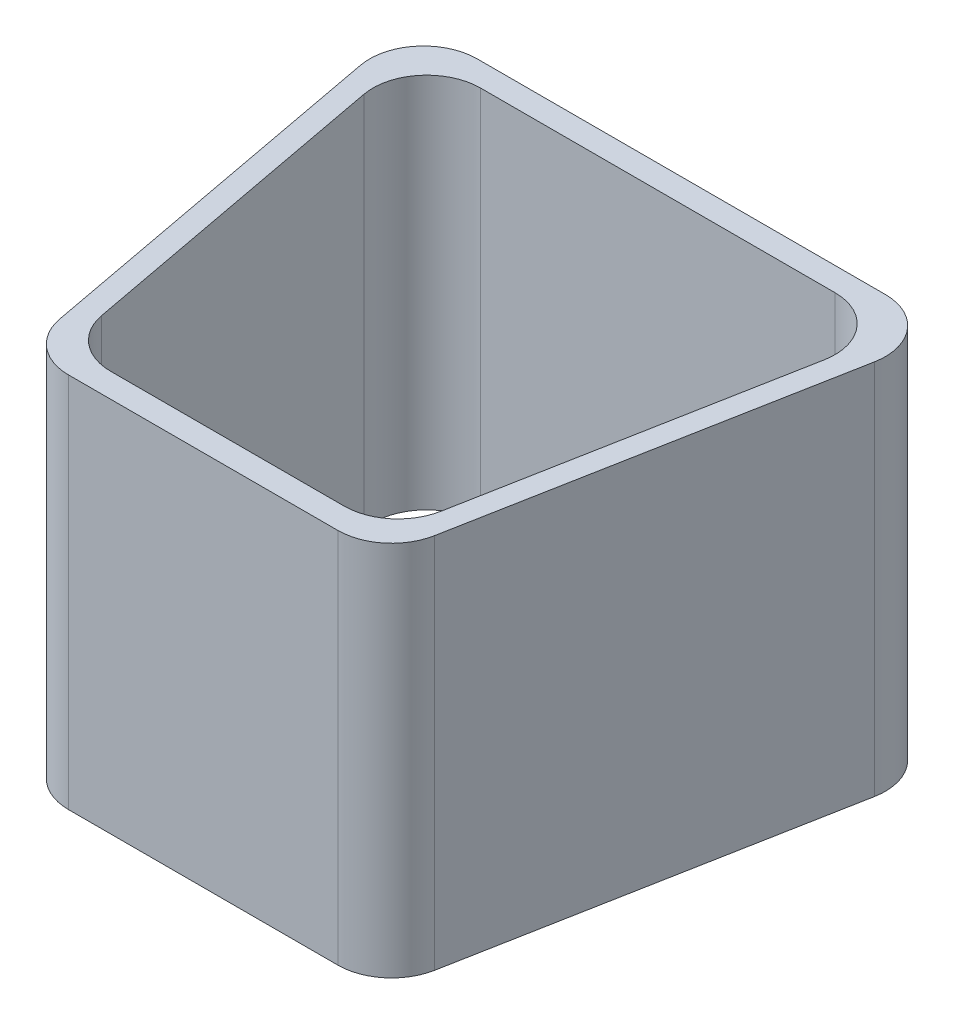
from build123d import *

# Parameters (mm, degrees)
BOSS_EXTRUDE1_DEPTH = 8.89
CUT_EXTRUDE3_DEPTH  = 25.335696378


with BuildPart() as part:
    # Sketch1 → Boss-Extrude1 (new, symmetric)
    with BuildSketch(Plane(origin=(0, 0, 0), x_dir=(1, 0, 0), z_dir=(0, 1, 0))):
        with BuildLine():
            Line((-9.63948723, 11.274777778), (9.63948723, 11.274777778))
            ThreePointArc((9.63948723, 11.274777778), (11.594040365, 10.356912804), (12.135982585, 8.266684899))
            Line((12.135982585, 8.266684899), (8.855149252, -9.231092879))
            ThreePointArc((8.855149252, -9.231092879), (7.980788923, -10.717553135), (6.358653897, -11.303))
            Line((6.358653897, -11.303), (-6.358653897, -11.303))
            ThreePointArc((-6.358653897, -11.303), (-7.980788923, -10.717553135), (-8.855149252, -9.231092879))
            Line((-8.855149252, -9.231092879), (-12.135982585, 8.266684899))
            ThreePointArc((-12.135982585, 8.266684899), (-11.594040365, 10.356912804), (-9.63948723, 11.274777778))
        make_face()
    extrude(amount=BOSS_EXTRUDE1_DEPTH, both=True)

    # Sketch2 → Cut-Extrude3 (cut, through all)
    with BuildSketch(Plane(origin=(0, 8.89, 0), x_dir=(1, 0, 0), z_dir=(0, 1, 0))):
        with BuildLine():
            Line((-8.36948723, 10.16), (8.36948723, 10.16))
            ThreePointArc((8.36948723, 10.16), (10.324040365, 9.242135026), (10.865982585, 7.151907121))
            Line((10.865982585, 7.151907121), (8.008482585, -8.088092879))
            ThreePointArc((8.008482585, -8.088092879), (7.134122257, -9.574553135), (5.51198723, -10.16))
            Line((5.51198723, -10.16), (-5.51198723, -10.16))
            ThreePointArc((-5.51198723, -10.16), (-7.134122257, -9.574553135), (-8.008482585, -8.088092879))
            Line((-8.008482585, -8.088092879), (-10.865982585, 7.151907121))
            ThreePointArc((-10.865982585, 7.151907121), (-10.324040365, 9.242135026), (-8.36948723, 10.16))
        make_face()
    extrude(amount=-CUT_EXTRUDE3_DEPTH, mode=Mode.SUBTRACT)


solid = part.part
